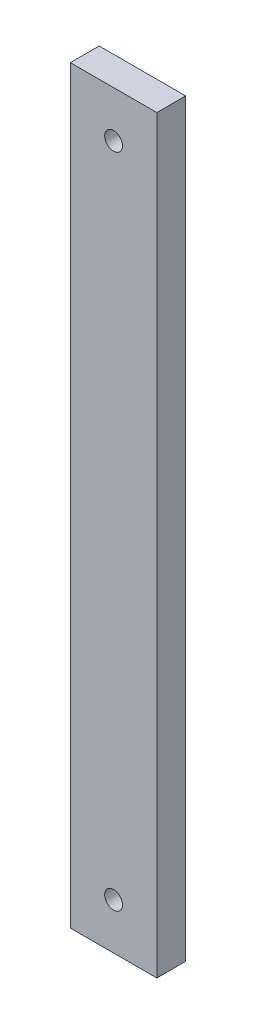
from build123d import *

# Parameters (mm, degrees)
SKETCH1_W           = 15
SKETCH1_H           = 130
SKETCH1_R           = 1.55
BOSS_EXTRUDE1_DEPTH = 5


with BuildPart() as part:
    # Sketch1 → Boss-Extrude1 (new body)
    with BuildSketch(Plane.XY):
        Rectangle(SKETCH1_W, SKETCH1_H)
        with Locations((0, 57)):
            Circle(SKETCH1_R, mode=Mode.SUBTRACT)
        with Locations((0, -57)):
            Circle(SKETCH1_R, mode=Mode.SUBTRACT)
    extrude(amount=BOSS_EXTRUDE1_DEPTH)


solid = part.part
